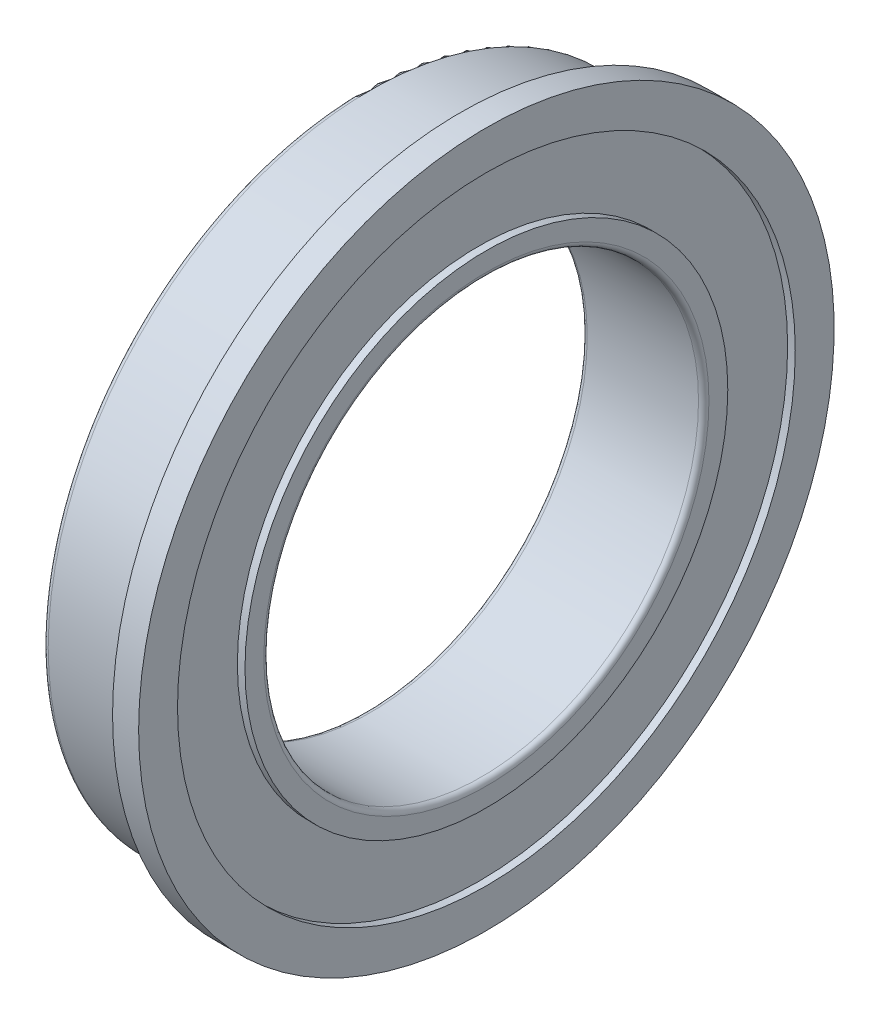
from build123d import *

# Parameters (mm, degrees)
PATTERN_CIRCULAR_5_COUNT = 18
SKETCH_1_3_W             = 0.2
SKETCH_1_3_H             = 3.88
FILLET_1_R               = 0.3
FILLET_2_R               = 0.3


with BuildPart() as part:
    # ｽｹｯﾁ1 → 回転1 (revolve)
    with BuildSketch(Plane.XY):
        with BuildLine():
            Line((0, 17.763), (0, 20))
            Line((0, 20), (-1.5, 20))
            Line((-1.5, 20), (-1.5, 18.7))
            ThreePointArc((-1.5, 18.7), (-1.358578644, 18.358578644), (-1.7, 18.5))
            Line((-1.7, 18.5), (-7, 18.5))
            Line((-7, 18.5), (-7, 17.763))
            Line((-7, 17.763), (-6.362, 17.763))
            Line((-6.362, 17.763), (-6.362, 16.923))
            Line((-6.362, 16.923), (-4.519803903, 16.923))
            ThreePointArc((-4.519803903, 16.923), (-3.5, 17.323), (-2.480196097, 16.923))
            Line((-2.480196097, 16.923), (-0.638, 16.923))
            Line((-0.638, 16.923), (-0.638, 17.763))
            Line((-0.638, 17.763), (0, 17.763))
        make_face()
        with BuildLine():
            Line((0, 13.883), (-0.638, 13.883))
            Line((-0.638, 13.883), (-0.638, 14.723))
            Line((-0.638, 14.723), (-2.480196097, 14.723))
            ThreePointArc((-2.480196097, 14.723), (-3.5, 14.323), (-4.519803903, 14.723))
            Line((-4.519803903, 14.723), (-6.362, 14.723))
            Line((-6.362, 14.723), (-6.362, 13.883))
            Line((-6.362, 13.883), (-7, 13.883))
            Line((-7, 13.883), (-7, 12.5))
            Line((-7, 12.5), (0, 12.5))
            Line((0, 12.5), (0, 13.883))
        make_face()
    revolve(axis=Axis((0, 0, 0), (1, 0, 0)))

    # ﾌｨﾚｯﾄ1
    fillet_1_edges = [part.edges().sort_by_distance(p)[0] for p in [
        (0, -12.5, 0),
        (-7, -12.5, 0),
    ]]
    fillet(fillet_1_edges, radius=FILLET_1_R)

    # ﾌｨﾚｯﾄ2
    fillet_2_edges = [part.edges().sort_by_distance(p)[0] for p in [
        (-7, -18.5, 0),
    ]]
    fillet(fillet_2_edges, radius=FILLET_2_R)


with BuildPart() as body_2:
    # ｽｹｯﾁ1<4> → 回転3 (revolve)
    with BuildSketch(Plane.XY):
        with BuildLine():
            ThreePointArc((-2, 15.823), (-2.125280782, 16.423122548), (-2.480196097, 16.923))
            ThreePointArc((-2.480196097, 16.923), (-3.5, 17.323), (-4.519803903, 16.923))
            ThreePointArc((-4.519803903, 16.923), (-4.874719218, 16.423122548), (-5, 15.823))
            Line((-5, 15.823), (-2, 15.823))
        make_face()
    revolve(axis=Axis((-7, 15.823, 0), (1, 0, 0)))


with BuildPart() as pattern_circular_5_1:
    # 円形ﾊﾟﾀｰﾝ5: pattern copy
    add(body_2.part.rotate(Axis((0, 0, 0), (-1, 0, 0)), 1 * 360 / PATTERN_CIRCULAR_5_COUNT))


with BuildPart() as pattern_circular_5_2:
    # 円形ﾊﾟﾀｰﾝ5: pattern copy
    add(body_2.part.rotate(Axis((0, 0, 0), (-1, 0, 0)), 2 * 360 / PATTERN_CIRCULAR_5_COUNT))


with BuildPart() as pattern_circular_5_3:
    # 円形ﾊﾟﾀｰﾝ5: pattern copy
    add(body_2.part.rotate(Axis((0, 0, 0), (-1, 0, 0)), 3 * 360 / PATTERN_CIRCULAR_5_COUNT))


with BuildPart() as pattern_circular_5_4:
    # 円形ﾊﾟﾀｰﾝ5: pattern copy
    add(body_2.part.rotate(Axis((0, 0, 0), (-1, 0, 0)), 4 * 360 / PATTERN_CIRCULAR_5_COUNT))


with BuildPart() as pattern_circular_5_5:
    # 円形ﾊﾟﾀｰﾝ5: pattern copy
    add(body_2.part.rotate(Axis((0, 0, 0), (-1, 0, 0)), 5 * 360 / PATTERN_CIRCULAR_5_COUNT))


with BuildPart() as pattern_circular_5_6:
    # 円形ﾊﾟﾀｰﾝ5: pattern copy
    add(body_2.part.rotate(Axis((0, 0, 0), (-1, 0, 0)), 6 * 360 / PATTERN_CIRCULAR_5_COUNT))


with BuildPart() as pattern_circular_5_7:
    # 円形ﾊﾟﾀｰﾝ5: pattern copy
    add(body_2.part.rotate(Axis((0, 0, 0), (-1, 0, 0)), 7 * 360 / PATTERN_CIRCULAR_5_COUNT))


with BuildPart() as pattern_circular_5_8:
    # 円形ﾊﾟﾀｰﾝ5: pattern copy
    add(body_2.part.rotate(Axis((0, 0, 0), (-1, 0, 0)), 8 * 360 / PATTERN_CIRCULAR_5_COUNT))


with BuildPart() as pattern_circular_5_9:
    # 円形ﾊﾟﾀｰﾝ5: pattern copy
    add(body_2.part.rotate(Axis((0, 0, 0), (-1, 0, 0)), 9 * 360 / PATTERN_CIRCULAR_5_COUNT))


with BuildPart() as pattern_circular_5_10:
    # 円形ﾊﾟﾀｰﾝ5: pattern copy
    add(body_2.part.rotate(Axis((0, 0, 0), (-1, 0, 0)), 10 * 360 / PATTERN_CIRCULAR_5_COUNT))


with BuildPart() as pattern_circular_5_11:
    # 円形ﾊﾟﾀｰﾝ5: pattern copy
    add(body_2.part.rotate(Axis((0, 0, 0), (-1, 0, 0)), 11 * 360 / PATTERN_CIRCULAR_5_COUNT))


with BuildPart() as pattern_circular_5_12:
    # 円形ﾊﾟﾀｰﾝ5: pattern copy
    add(body_2.part.rotate(Axis((0, 0, 0), (-1, 0, 0)), 12 * 360 / PATTERN_CIRCULAR_5_COUNT))


with BuildPart() as pattern_circular_5_13:
    # 円形ﾊﾟﾀｰﾝ5: pattern copy
    add(body_2.part.rotate(Axis((0, 0, 0), (-1, 0, 0)), 13 * 360 / PATTERN_CIRCULAR_5_COUNT))


with BuildPart() as pattern_circular_5_14:
    # 円形ﾊﾟﾀｰﾝ5: pattern copy
    add(body_2.part.rotate(Axis((0, 0, 0), (-1, 0, 0)), 14 * 360 / PATTERN_CIRCULAR_5_COUNT))


with BuildPart() as pattern_circular_5_15:
    # 円形ﾊﾟﾀｰﾝ5: pattern copy
    add(body_2.part.rotate(Axis((0, 0, 0), (-1, 0, 0)), 15 * 360 / PATTERN_CIRCULAR_5_COUNT))


with BuildPart() as pattern_circular_5_16:
    # 円形ﾊﾟﾀｰﾝ5: pattern copy
    add(body_2.part.rotate(Axis((0, 0, 0), (-1, 0, 0)), 16 * 360 / PATTERN_CIRCULAR_5_COUNT))


with BuildPart() as pattern_circular_5_17:
    # 円形ﾊﾟﾀｰﾝ5: pattern copy
    add(body_2.part.rotate(Axis((0, 0, 0), (-1, 0, 0)), 17 * 360 / PATTERN_CIRCULAR_5_COUNT))


with BuildPart() as body_20:
    # ｽｹｯﾁ1<3> → 回転2 (revolve)
    with BuildSketch(Plane.XY):
        with Locations((-0.538, 15.823)):
            Rectangle(SKETCH_1_3_W, SKETCH_1_3_H)
        with Locations((-6.462, 15.823)):
            Rectangle(SKETCH_1_3_W, SKETCH_1_3_H)
    revolve(axis=Axis((0, 0, 0), (1, 0, 0)))


solid = Compound([part.part, body_2.part, pattern_circular_5_1.part, pattern_circular_5_2.part, pattern_circular_5_3.part, pattern_circular_5_4.part, pattern_circular_5_5.part, pattern_circular_5_6.part, pattern_circular_5_7.part, pattern_circular_5_8.part, pattern_circular_5_9.part, pattern_circular_5_10.part, pattern_circular_5_11.part, pattern_circular_5_12.part, pattern_circular_5_13.part, pattern_circular_5_14.part, pattern_circular_5_15.part, pattern_circular_5_16.part, pattern_circular_5_17.part, body_20.part])
